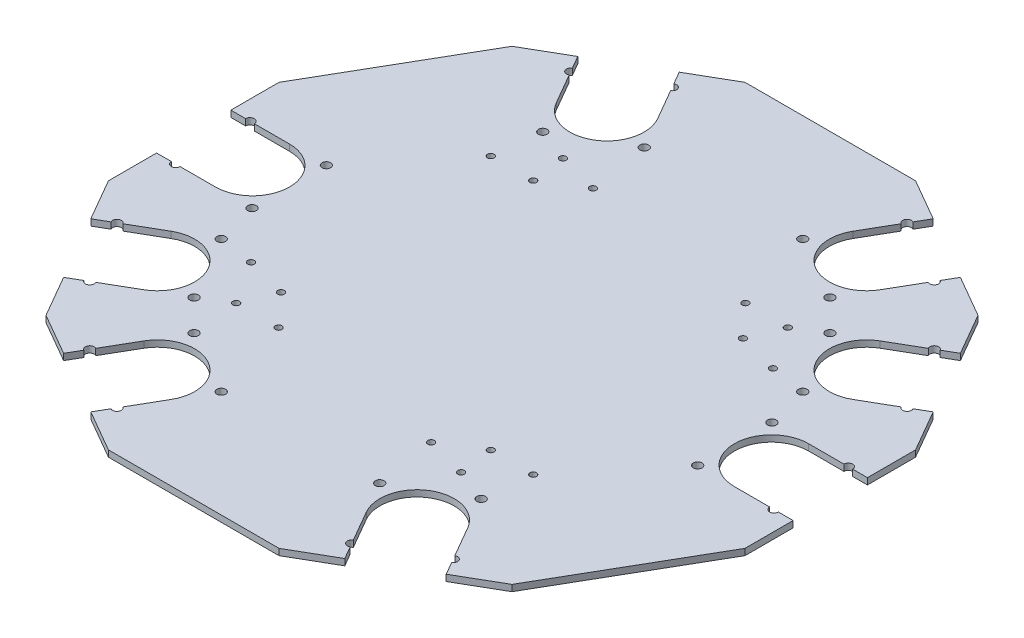
from build123d import *

# Parameters (mm, degrees)
BOSS_EXTRUDE1_DEPTH     = 3
SKETCH2_R               = 2.05
HEXCUT1_DEPTH           = 3
SKETCH5_R               = 1.55
RAILMOUNTHOLES_DEPTH    = 3
LPATTERN1_COUNT         = 2
LPATTERN1_PITCH         = 120
LPATTERN1_COUNT_DIR2    = 2
LPATTERN1_PITCH_DIR2    = 120
SKETCH6_R               = 2.05
QUADCUT1_DEPTH          = 3
CUT_EXTRUDE3_DEPTH      = 3
CUT_EXTRUDE4_DEPTH      = 3
SKETCH9_R               = 1.55
CUT_EXTRUDE5_DEPTH      = 3
MIRROR6_COPY_1_SKETCH_R = 1.55
MIRROR6_COPY_1_DEPTH    = 3
MIRROR6_COPY_2_SKETCH_R = 1.55
MIRROR6_COPY_2_DEPTH    = 3


with BuildPart() as part:
    # Sketch1 → Boss-Extrude1 (new body)
    with BuildSketch(Plane(origin=(0, 0, 0), x_dir=(1, 0, 0), z_dir=(0, 1, 0))):
        Polygon((150, -40.192378865), (150, 40.192378865), (109.807621135, 109.807621135), (40.192378865, 150), (-40.192378865, 150), (-109.807621135, 109.807621135), (-150, 40.192378865), (-150, -40.192378865), (-109.807621135, -109.807621135), (-40.192378865, -150), (40.192378865, -150), (109.807621135, -109.807621135), align=None)
    extrude(amount=BOSS_EXTRUDE1_DEPTH)

    # Sketch2 → HexCut1 (cut)
    with BuildSketch(Plane(origin=(0, 3, 0), x_dir=(1, 0, 0), z_dir=(0, 1, 0))):
        with Locations(Location((55.344555434, 130.859581934, 0), (0, 0, 270))):
            Circle(SKETCH2_R)
        with Locations(Location((37.344555434, 99.682667397, 0), (0, 0, 270))):
            Circle(SKETCH2_R)
        with Locations(Location((37.344555434, -99.682667397, 0), (0, 0, 270))):
            Circle(SKETCH2_R)
        with Locations(Location((55.344555434, -130.859581934, 0), (0, 0, 270))):
            Circle(SKETCH2_R)
        with Locations(Location((105, 17.5, 0), (0, 0, 270))):
            Circle(SKETCH2_R)
        with Locations(Location((141, 17.5, 0), (0, 0, 270))):
            Circle(SKETCH2_R)
        with Locations(Location((105, -17.5, 0), (0, 0, 270))):
            Circle(SKETCH2_R)
        with Locations(Location((141, -17.5, 0), (0, 0, 270))):
            Circle(SKETCH2_R)
        with Locations(Location((85.655444566, -113.359581934, 0), (0, 0, 270))):
            Circle(SKETCH2_R)
        with Locations(Location((67.655444566, -82.182667397, 0), (0, 0, 270))):
            Circle(SKETCH2_R)
        with Locations(Location((85.655444566, 113.359581934, 0), (0, 0, 270))):
            Circle(SKETCH2_R)
        with Locations(Location((67.655444566, 82.182667397, 0), (0, 0, 270))):
            Circle(SKETCH2_R)
    hexcut1 = extrude(amount=-HEXCUT1_DEPTH, mode=Mode.SUBTRACT)

    # HexCut2: HexCut1 across plane
    add(hexcut1.mirror(Plane(origin=(0, 0, 0), x_dir=(0, 0, 1), z_dir=(1, 0, 0))), mode=Mode.SUBTRACT)

    # Sketch5 → RailMountHoles (cut)
    with BuildSketch(Plane(origin=(0, 3, 0), x_dir=(1, 0, 0), z_dir=(0, 1, 0))):
        with Locations(Location((50, 60, 0), (0, 0, 270))):
            Circle(SKETCH5_R)
        with Locations(Location((70, 60, 0), (0, 0, 270))):
            Circle(SKETCH5_R)
    railmountholes = extrude(amount=-RAILMOUNTHOLES_DEPTH, mode=Mode.SUBTRACT)

    # LPattern1: RailMountHoles 2 × 2
    with Locations(*[(-j * LPATTERN1_PITCH_DIR2, 0, i * LPATTERN1_PITCH) for i in range(LPATTERN1_COUNT) for j in range(LPATTERN1_COUNT_DIR2) if (i, j) != (0, 0)]):
        add(railmountholes, mode=Mode.SUBTRACT)

    # Sketch6 → QuadCut1 (cut)
    with BuildSketch(Plane(origin=(0, 3, 0), x_dir=(1, 0, 0), z_dir=(0, 1, 0))):
        with Locations(Location((99.682667397, 37.344555434, 0), (0, 0, 270))):
            Circle(SKETCH6_R)
        with Locations(Location((130.859581934, 55.344555434, 0), (0, 0, 270))):
            Circle(SKETCH6_R)
        with Locations(Location((113.359581934, 85.655444566, 0), (0, 0, 270))):
            Circle(SKETCH6_R)
        with Locations(Location((82.182667397, 67.655444566, 0), (0, 0, 270))):
            Circle(SKETCH6_R)
    quadcut1 = extrude(amount=-QUADCUT1_DEPTH, mode=Mode.SUBTRACT)

    # Mirror1: QuadCut1 across plane
    add(quadcut1.mirror(Plane(origin=(0, 0, 0), x_dir=(0.5000000000000011, 0, 0.8660254037844378), z_dir=(0.8660254037844379, 0, -0.5000000000000012))), mode=Mode.SUBTRACT)

    # Sketch7 → Cut-Extrude3 (cut)
    with BuildSketch(Plane(origin=(0, 3, 0), x_dir=(1, 0, 0), z_dir=(0, 1, 0))):
        with BuildLine():
            Line((45.994555434, 114.664906883), (83.494555434, 179.616812167))
            Line((83.494555434, 179.616812167), (113.805444566, 162.116812167))
            Line((113.805444566, 162.116812167), (76.305444566, 97.164906883))
            ThreePointArc((76.305444566, 97.164906883), (52.4, 90.759462317), (45.994555434, 114.664906883))
        make_face()
        with BuildLine():
            Line((45.994555434, -114.664906883), (83.494555434, -179.616812167))
            Line((83.494555434, -179.616812167), (113.805444566, -162.116812167))
            Line((113.805444566, -162.116812167), (76.305444566, -97.164906883))
            ThreePointArc((76.305444566, -97.164906883), (52.4, -90.759462317), (45.994555434, -114.664906883))
        make_face()
        with BuildLine():
            Line((122.3, 17.5), (162.3, 17.5))
            Line((162.3, 17.5), (162.3, -17.5))
            Line((162.3, -17.5), (122.3, -17.5))
            ThreePointArc((122.3, -17.5), (104.8, 0), (122.3, 17.5))
        make_face()
    cut_extrude3 = extrude(amount=-CUT_EXTRUDE3_DEPTH, mode=Mode.SUBTRACT)

    # Mirror2: Cut-Extrude3 across plane
    add(cut_extrude3.mirror(Plane(origin=(0, 0, 0), x_dir=(0, 0, 1), z_dir=(1, 0, 0))), mode=Mode.SUBTRACT)

    # Sketch8 → Cut-Extrude4 (cut)
    with BuildSketch(Plane(origin=(0, 3, 0), x_dir=(1, 0, 0), z_dir=(0, 1, 0))):
        with BuildLine():
            Line((97.164906883, 76.305444566), (131.805923034, 96.305444566))
            Line((131.805923034, 96.305444566), (149.305923034, 65.994555434))
            Line((149.305923034, 65.994555434), (114.664906883, 45.994555434))
            ThreePointArc((114.664906883, 45.994555434), (90.759462317, 52.4), (97.164906883, 76.305444566))
        make_face()
    cut_extrude4 = extrude(amount=-CUT_EXTRUDE4_DEPTH, mode=Mode.SUBTRACT)

    # Mirror3: Cut-Extrude4 across plane
    add(cut_extrude4.mirror(Plane(origin=(0, 0, 0), x_dir=(0.5000000000000011, 0, 0.8660254037844378), z_dir=(0.8660254037844379, 0, -0.5000000000000012))), mode=Mode.SUBTRACT)

    # Sketch9 → Cut-Extrude5 (cut)
    with BuildSketch(Plane(origin=(0, 3, 0), x_dir=(1, 0, 0), z_dir=(0, 1, 0))):
        with Locations(Location((63.825434021, 45.014597322, 0), (0, 0, 270))):
            Circle(SKETCH9_R)
        with Locations(Location((83.143950546, 39.83821642, 0), (0, 0, 270))):
            Circle(SKETCH9_R)
    cut_extrude5 = extrude(amount=-CUT_EXTRUDE5_DEPTH, mode=Mode.SUBTRACT)

    # Mirror4: Cut-Extrude5 across plane
    add(cut_extrude5.mirror(Plane(origin=(0, 0, 0), x_dir=(0.9659258262890692, 0, 0.2588190451025174), z_dir=(0.2588190451025174, 0, -0.9659258262890692))), mode=Mode.SUBTRACT)

    # Mirror5: Cut-Extrude5 across plane
    add(cut_extrude5.mirror(Plane(origin=(0, 0, 0), x_dir=(-0.2588190451025206, 0, 0.9659258262890683), z_dir=(0.9659258262890683, 0, 0.2588190451025206))), mode=Mode.SUBTRACT)

    # Mirror6 copy 1 sketch → Mirror6 copy 1 (cut)
    with BuildSketch(Plane(origin=(0, 3, 0), x_dir=(-1, 0, 0), z_dir=(0, 1, 0))):
        with Locations(Location((63.825434021, 45.014597322, 0), (0, 0, 270))):
            Circle(MIRROR6_COPY_1_SKETCH_R)
        with Locations(Location((83.143950546, 39.83821642, 0), (0, 0, 270))):
            Circle(MIRROR6_COPY_1_SKETCH_R)
    extrude(amount=-MIRROR6_COPY_1_DEPTH, mode=Mode.SUBTRACT)

    # Mirror6 copy 2 sketch → Mirror6 copy 2 (cut)
    with BuildSketch(Plane(origin=(0, 3, 0), x_dir=(-0.8660254037844388, 0, -0.49999999999999967), z_dir=(0, 1, 0))):
        with Locations((63.825434021, -45.014597322)):
            Circle(MIRROR6_COPY_2_SKETCH_R)
        with Locations((83.143950546, -39.83821642)):
            Circle(MIRROR6_COPY_2_SKETCH_R)
    extrude(amount=-MIRROR6_COPY_2_DEPTH, mode=Mode.SUBTRACT)


solid = part.part
